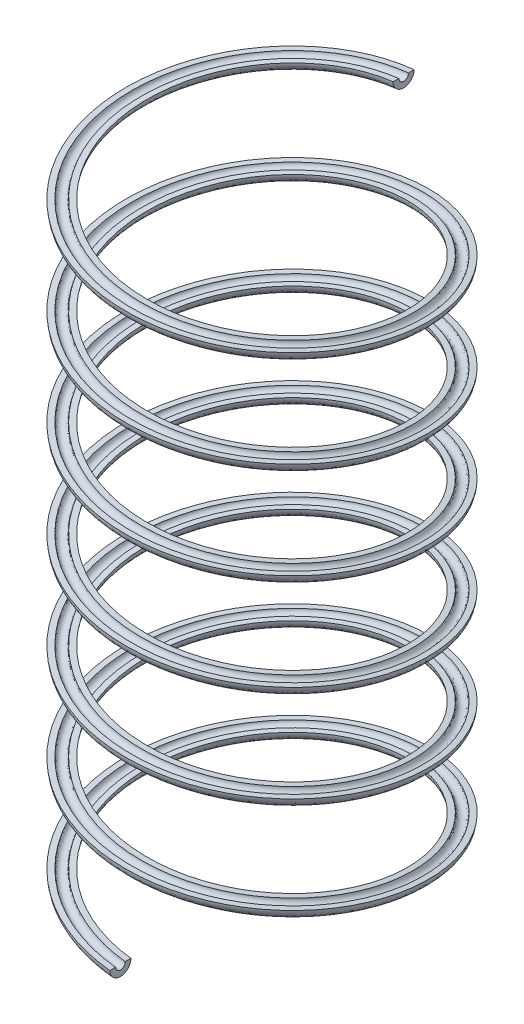
from build123d import *

# Parameters (mm, degrees)
SWEEP_1_PITCH  = 11.928571429
SWEEP_1_HEIGHT = 77.535714286
SWEEP_1_RADIUS = 17.5


with BuildPart() as part:
    # 掃出1: sweep along a helix
    with BuildLine() as sweep_1_path:
        Helix(SWEEP_1_PITCH, SWEEP_1_HEIGHT, SWEEP_1_RADIUS, center=(0, 0, 0), direction=(0, 1, 0), lefthand=True)
    # 草圖6 → 掃出1 (sweep)
    with BuildSketch(Plane(origin=(0, 0, 0), x_dir=(0, 0, -1), z_dir=(1, 0, 0))):
        with BuildLine():
            Line((16.185499734, 77.527434429), (16.885499734, 77.527434429))
            ThreePointArc((16.885499734, 77.527434429), (17.485499734, 76.927434429), (18.085499734, 77.527434429))
            Line((18.085499734, 77.527434429), (18.785499734, 77.527434429))
            ThreePointArc((18.785499734, 77.527434429), (17.485499734, 76.227434429), (16.185499734, 77.527434429))
        make_face()
    sweep(path=sweep_1_path.line, is_frenet=True)


solid = part.part
